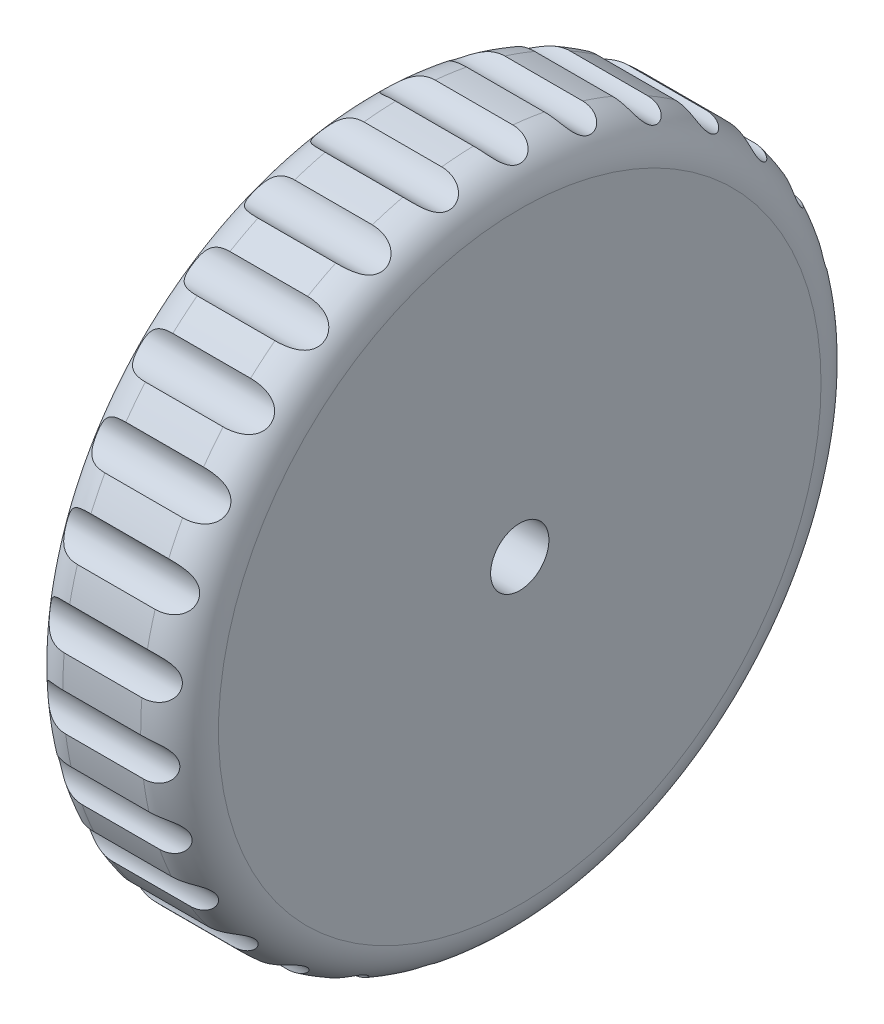
from build123d import *

# Parameters (mm, degrees)
BOSS_EXTRUDE1_DEPTH      = 40
BOSS_EXTRUDE1_DEPTH_BACK = 40
SKETCH1_R                = 175
FILLET1_R                = 20
SKETCH2_R                = 12.207749944
CUT_EXTRUDE1_DEPTH       = 40
CIRPATTERN1_COUNT        = 30
CUT_EXTRUDE2_DEPTH       = 40
CUT_EXTRUDE2_DEPTH_BACK  = 40
SKETCH3_R                = 15


with BuildPart() as part:
    # Sketch1 → Boss-Extrude1 (new, two sides: drawn at the far end of the back side and taken through both)
    with BuildSketch(Plane(origin=(0, 0, 0), x_dir=(0, 0, -1), z_dir=(1, 0, 0)).offset(-BOSS_EXTRUDE1_DEPTH_BACK)):
        with Locations((-45.994486924, -4.927980742)):
            Circle(SKETCH1_R)
    extrude(amount=BOSS_EXTRUDE1_DEPTH + BOSS_EXTRUDE1_DEPTH_BACK)

    # Fillet1
    fillet1_edges = [part.edges().sort_by_distance(p)[0] for p in [
        (40, -4.927980742, 220.994486924),
        (-40, -4.927980742, 220.994486924),
    ]]
    fillet(fillet1_edges, radius=FILLET1_R)

    # Sketch2 → Cut-Extrude1 (cut, symmetric)
    with BuildSketch(Plane(origin=(0, 0, 0), x_dir=(0, 0, -1), z_dir=(1, 0, 0))):
        with Locations((-176.402330518, 121.298483786)):
            Circle(SKETCH2_R)
    cut_extrude1 = extrude(amount=CUT_EXTRUDE1_DEPTH, both=True, mode=Mode.SUBTRACT)

    # CirPattern1: Cut-Extrude1 ×30 about axis
    cirpattern1_axis = Axis((-40, -4.927980742, 45.994486924), (1, 0, 0))
    for i in range(1, CIRPATTERN1_COUNT):
        add(cut_extrude1.rotate(cirpattern1_axis, i * 360 / CIRPATTERN1_COUNT), mode=Mode.SUBTRACT)

    # Sketch3 → Cut-Extrude2 (cut, two sides: drawn at the far end of the back side and taken through both)
    with BuildSketch(Plane(origin=(0, 0, 0), x_dir=(0, 0, -1), z_dir=(1, 0, 0)).offset(-CUT_EXTRUDE2_DEPTH_BACK)):
        with Locations((-45.994486924, -4.927980742)):
            Circle(SKETCH3_R)
    extrude(amount=CUT_EXTRUDE2_DEPTH + CUT_EXTRUDE2_DEPTH_BACK, mode=Mode.SUBTRACT)


solid = part.part
